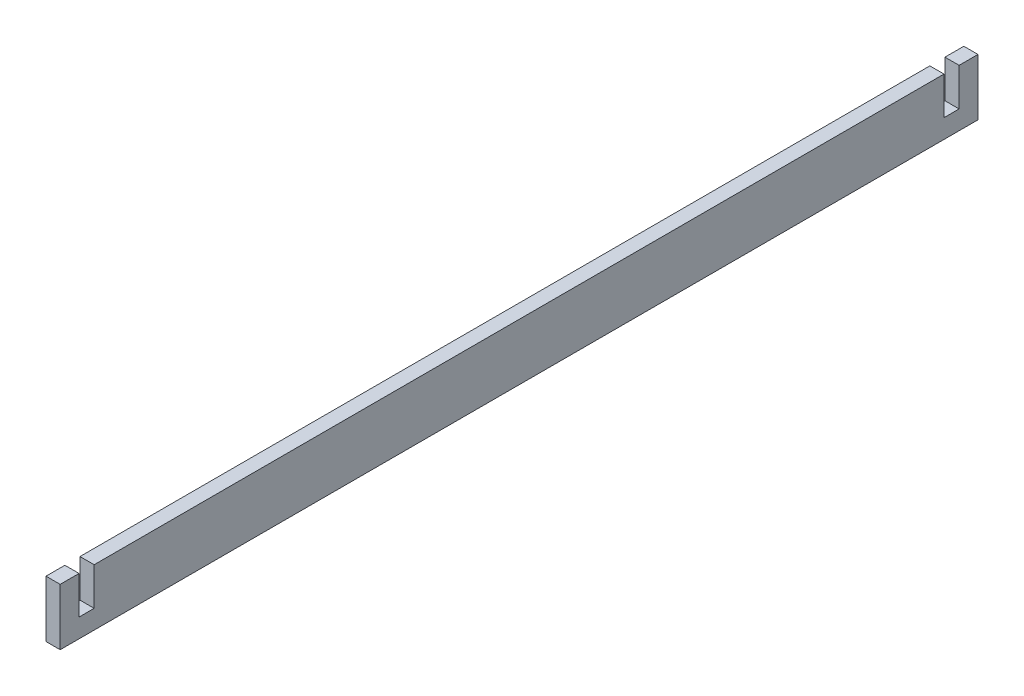
from build123d import *

# Parameters (mm, degrees)
BOSS_EXTRUDE1_DEPTH = 3


with BuildPart() as part:
    # Sketch1 → Boss-Extrude1 (new body)
    with BuildSketch(Plane(origin=(0, 0, 0), x_dir=(0, 0, -1), z_dir=(1, 0, 0))):
        Polygon((-97.2, 12), (-97.2, 0), (97.2, 0), (97.2, 12), (93.2, 12), (93.2, 4), (90, 4), (90, 12), (-90, 12), (-90, 4), (-93.2, 4), (-93.2, 12), align=None)
    extrude(amount=BOSS_EXTRUDE1_DEPTH)


solid = part.part
